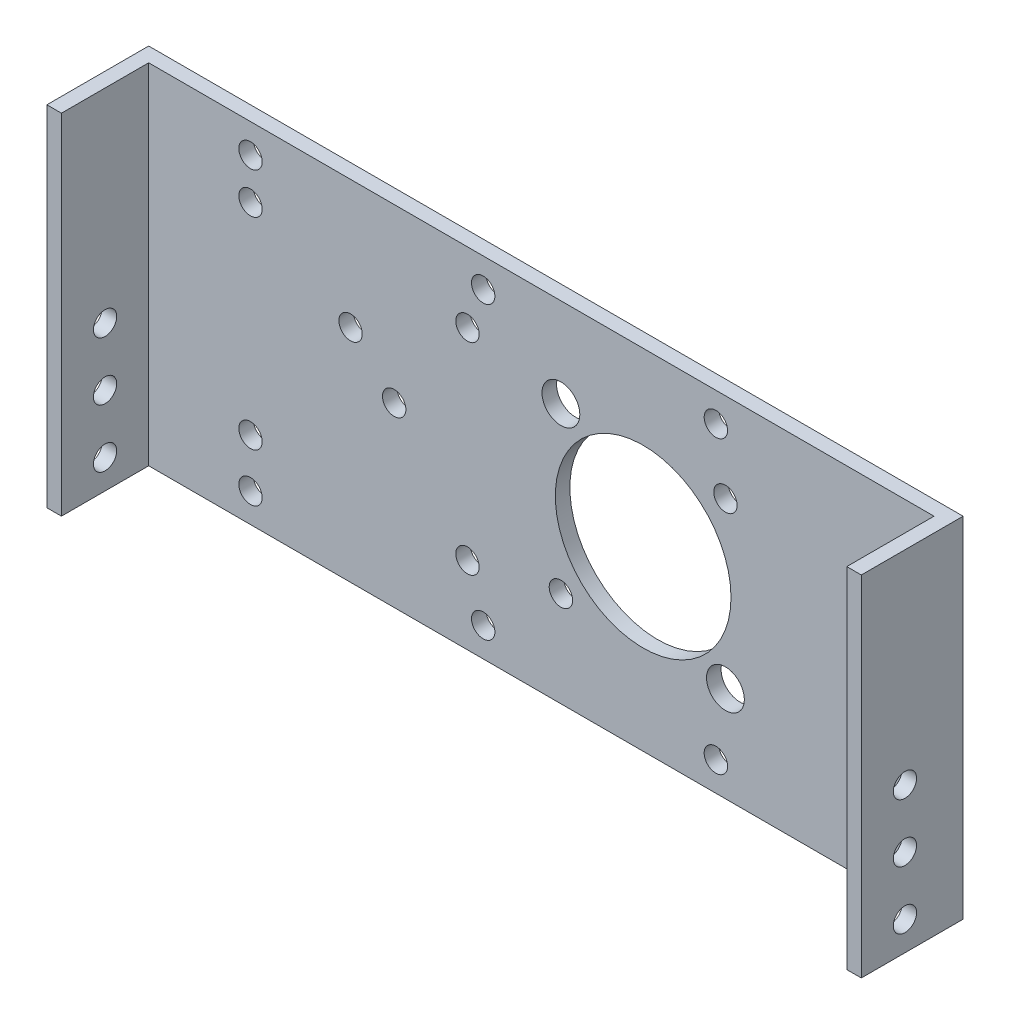
from build123d import *

# Parameters (mm, degrees)
SKETCH1_W           = 177.8
SKETCH1_H           = 76.2
SKETCH1_R           = 2.5527
SKETCH1_R_2         = 4.1275
SKETCH1_R_3         = 19.177
BOSS_EXTRUDE1_DEPTH = 3.175
SKETCH2_W           = 3.175
SKETCH2_H           = 76.2
BOSS_EXTRUDE2_DEPTH = 19.05
SKETCH3_R           = 2.54
CUT_EXTRUDE1_DEPTH  = 197.11331534


with BuildPart() as part:
    # Sketch1 → Boss-Extrude1 (new body)
    with BuildSketch(Plane.XY):
        with Locations((51.430541204, 41.609734844)):
            Rectangle(SKETCH1_W, SKETCH1_H)
        with Locations((89.530541204, 9.859734844)):
            Circle(SKETCH1_R, mode=Mode.SUBTRACT)
        with Locations((89.530541204, 73.359734844)):
            Circle(SKETCH1_R, mode=Mode.SUBTRACT)
        with Locations((-12.069458796, 73.359734844)):
            Circle(SKETCH1_R, mode=Mode.SUBTRACT)
        with Locations((-12.069458796, 64.427395008)):
            Circle(SKETCH1_R, mode=Mode.SUBTRACT)
        with Locations((38.730541204, 73.359734844)):
            Circle(SKETCH1_R, mode=Mode.SUBTRACT)
        with Locations((35.301541204, 64.427395008)):
            Circle(SKETCH1_R, mode=Mode.SUBTRACT)
        with Locations((9.774192889, 51.727395008)):
            Circle(SKETCH1_R, mode=Mode.SUBTRACT)
        with Locations((19.299192889, 42.202395008)):
            Circle(SKETCH1_R, mode=Mode.SUBTRACT)
        with Locations((-12.069458796, 20.433674276)):
            Circle(SKETCH1_R, mode=Mode.SUBTRACT)
        with Locations((35.301541204, 20.433674276)):
            Circle(SKETCH1_R, mode=Mode.SUBTRACT)
        with Locations((38.730541204, 9.859734844)):
            Circle(SKETCH1_R, mode=Mode.SUBTRACT)
        with Locations((55.695028962, 24.33315969)):
            Circle(SKETCH1_R, mode=Mode.SUBTRACT)
        with Locations((55.695028962, 60.254184174)):
            Circle(SKETCH1_R_2, mode=Mode.SUBTRACT)
        with Locations((91.616053446, 60.254184174)):
            Circle(SKETCH1_R, mode=Mode.SUBTRACT)
        with Locations((91.616053446, 24.33315969)):
            Circle(SKETCH1_R_2, mode=Mode.SUBTRACT)
        with Locations((73.655541204, 42.202395008)):
            Circle(SKETCH1_R_3, mode=Mode.SUBTRACT)
        with Locations((-12.069458796, 9.859734844)):
            Circle(SKETCH1_R, mode=Mode.SUBTRACT)
        with Locations((121.280541204, 42.202395008)):
            Circle(SKETCH1_R, mode=Mode.SUBTRACT)
    extrude(amount=BOSS_EXTRUDE1_DEPTH)

    # Sketch2 → Boss-Extrude2 (add)
    with BuildSketch(Plane.XY.offset(3.175)):
        with Locations((-35.881958796, 41.609734844)):
            Rectangle(SKETCH2_W, SKETCH2_H)
        with Locations((138.743041204, 41.609734844)):
            Rectangle(SKETCH2_W, SKETCH2_H)
    extrude(amount=BOSS_EXTRUDE2_DEPTH)

    # Sketch3 → Cut-Extrude1 (cut, through all)
    with BuildSketch(Plane(origin=(140.330541204, 0, 0), x_dir=(0, 0, -1), z_dir=(1, 0, 0))):
        with Locations((-12.7, 35.259734844)):
            Circle(SKETCH3_R)
        with Locations((-12.7, 22.559734844)):
            Circle(SKETCH3_R)
        with Locations((-12.7, 9.859734844)):
            Circle(SKETCH3_R)
    extrude(amount=-CUT_EXTRUDE1_DEPTH, mode=Mode.SUBTRACT)


solid = part.part
